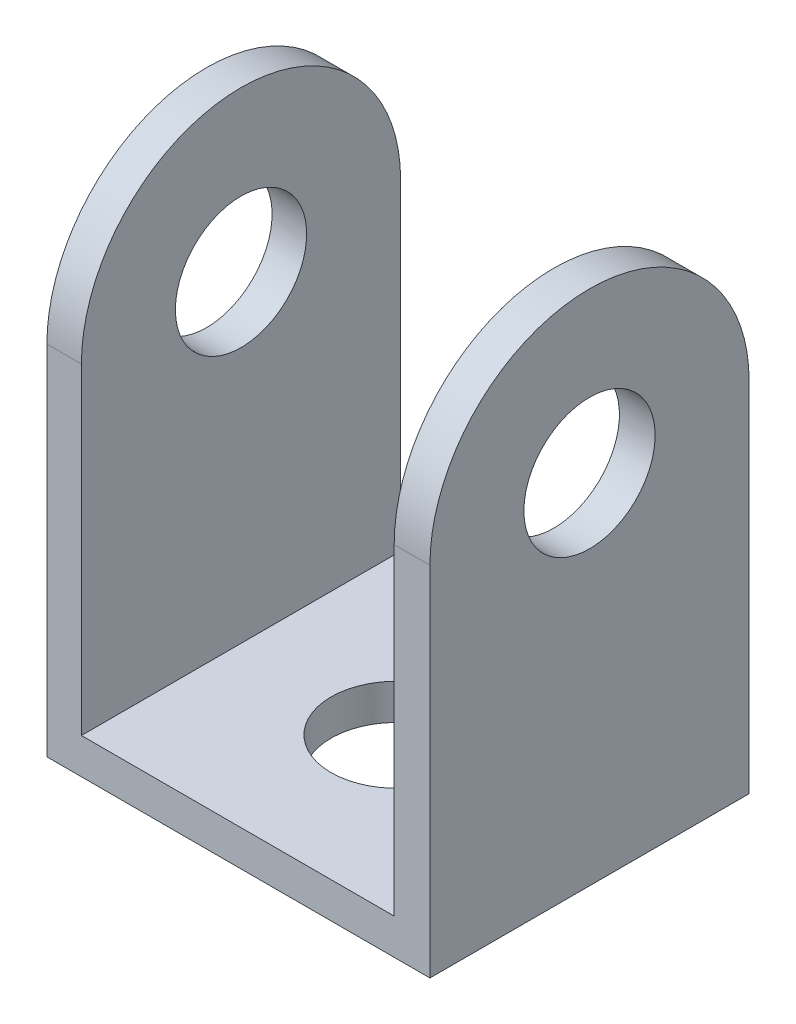
from build123d import *

# Parameters (mm, degrees)
SKETCH2_R           = 7.9375
SKETCH2_R_2         = 3.2639
BOSS_EXTRUDE1_DEPTH = 19.05
SKETCH3_W           = 15.555026682
SKETCH3_H           = 25.4
CUT_EXTRUDE1_DEPTH  = 12.7
SKETCH4_R           = 3.2639
CUT_EXTRUDE2_DEPTH  = 28.240315825


with BuildPart() as part:
    # Sketch2 → Boss-Extrude1 (new body)
    # profile 1 of 2: a face of its own
    with BuildSketch(Plane(origin=(0, 0, 0), x_dir=(0, 0, -1), z_dir=(1, 0, 0))):
        with BuildLine():
            ThreePointArc((7.9375, 0), (0, -7.9375), (-7.9375, 0))
            Line((-7.9375, 0), (-7.9375, -17.78))
            Line((-7.9375, -17.78), (7.9375, -17.78))
            Line((7.9375, -17.78), (7.9375, 0))
        make_face()
    # profile 2 of 2: a face of its own
    with BuildSketch(Plane(origin=(0, 0, 0), x_dir=(0, 0, -1), z_dir=(1, 0, 0))):
        Circle(SKETCH2_R)
        with Locations(Location((0, 0, 0), (0, 0, 180))):
            Circle(SKETCH2_R_2, mode=Mode.SUBTRACT)
    extrude(amount=BOSS_EXTRUDE1_DEPTH)

    # Sketch3 → Cut-Extrude1 (cut, symmetric)
    with BuildSketch(Plane.XY):
        with Locations((9.494486659, -3.302)):
            Rectangle(SKETCH3_W, SKETCH3_H)
    extrude(amount=CUT_EXTRUDE1_DEPTH, both=True, mode=Mode.SUBTRACT)

    # Sketch4 → Cut-Extrude2 (cut, through all)
    with BuildSketch(Plane(origin=(0, 0, 0), x_dir=(1, 0, 0), z_dir=(0, 1, 0))):
        with Locations(Location((9.525, -0.0635, 0), (0, 0, 270))):
            Circle(SKETCH4_R)
    extrude(amount=-CUT_EXTRUDE2_DEPTH, mode=Mode.SUBTRACT)


solid = part.part
